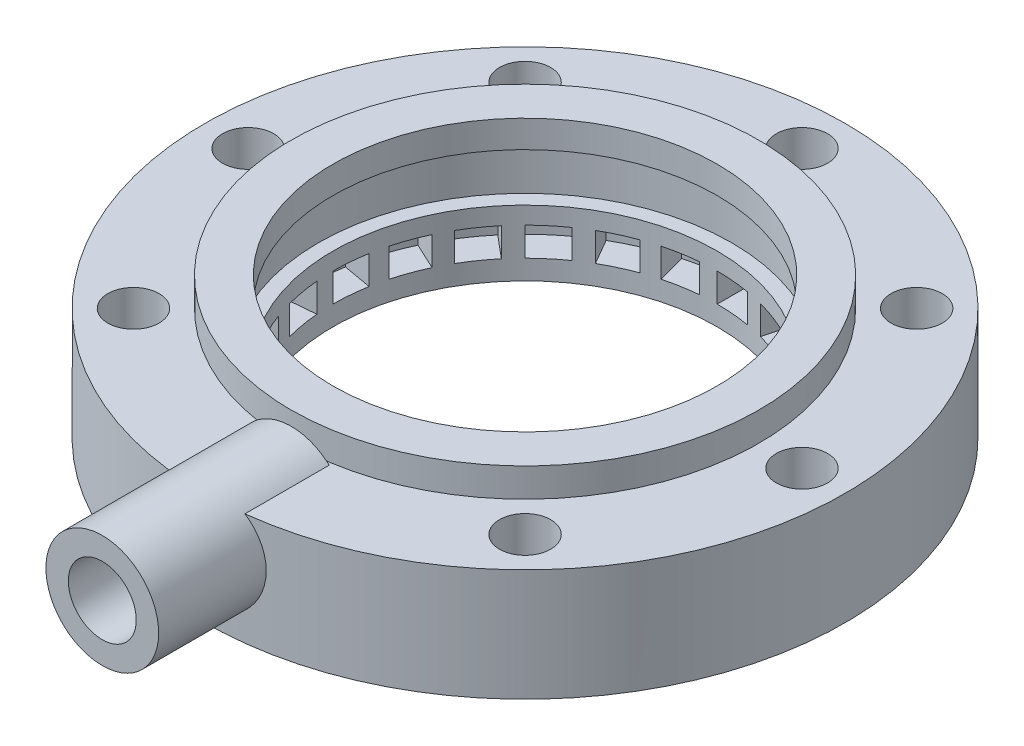
from build123d import *

# Parameters (mm, degrees)
SKETCH2_R               = 100
BOSS_EXTRUDE1_DEPTH     = 35
SKETCH3_R               = 60
CUT_EXTRUDE1_DEPTH      = 60
SKETCH4_R               = 73
BOSS_EXTRUDE3_DEPTH     = 44
SKETCH5_R               = 60
CUT_EXTRUDE2_DEPTH      = 60
SKETCH6_R               = 8
CUT_EXTRUDE3_DEPTH      = 146.688022843
SKETCH9_W               = 8
SKETCH9_H               = 8.939618961
CUT_REVOLVE2_ANGLE      = 10
CIRPATTERN1_COUNT       = 24
SKETCH10_W              = 4.5
SKETCH10_H              = 15
SKETCH11_W              = 1.287902171
SKETCH11_H              = 5.049148502
CUT_REVOLVE9_ANGLE      = 10
CIRPATTERN3_COUNT       = 24
SKETCH12_W              = 2.5
SKETCH12_H              = 25.096149883
CUT_REVOLVE13_ANGLE     = 10
CIRPATTERN4_COUNT       = 24
CUT_EXTRUDE4_DEPTH      = 34
CUT_EXTRUDE4_DEPTH_BACK = 6
SKETCH16_R              = 14
SKETCH19_W              = 2.480119558
SKETCH19_H              = 12.542318907
SKETCH20_R              = 17.602842061
SKETCH20_R_2            = 10.602842061
EXTRUDE_THIN1_DEPTH     = 59


with BuildPart() as part:
    # Sketch2 → Boss-Extrude1 (new body)
    with BuildSketch(Plane(origin=(0, 0, 0), x_dir=(1, 0, 0), z_dir=(0, 1, 0))):
        with Locations(Location((0, 0, 0), (0, 0, 270))):
            Circle(SKETCH2_R)
    extrude(amount=BOSS_EXTRUDE1_DEPTH)

    # Sketch3 → Cut-Extrude1 (cut)
    with BuildSketch(Plane(origin=(0, 0, 0), x_dir=(1, 0, 0), z_dir=(0, 1, 0))):
        with Locations(Location((0, 0, 0), (0, 0, 270))):
            Circle(SKETCH3_R)
    extrude(amount=CUT_EXTRUDE1_DEPTH, mode=Mode.SUBTRACT)

    # Sketch4 → Boss-Extrude3 (add)
    with BuildSketch(Plane(origin=(0, 0, 0), x_dir=(1, 0, 0), z_dir=(0, 1, 0))):
        with Locations(Location((0, 0, 0), (0, 0, 270))):
            Circle(SKETCH4_R)
    extrude(amount=BOSS_EXTRUDE3_DEPTH)

    # Sketch5 → Cut-Extrude2 (cut)
    with BuildSketch(Plane(origin=(0, 44, 0), x_dir=(1, 0, 0), z_dir=(0, 1, 0))):
        with Locations(Location((0, 0, 0), (0, 0, 270))):
            Circle(SKETCH5_R)
    extrude(amount=-CUT_EXTRUDE2_DEPTH, mode=Mode.SUBTRACT)

    # Sketch6 → Cut-Extrude3 (cut, through all)
    with BuildSketch(Plane(origin=(0, 35, 0), x_dir=(1, 0, 0), z_dir=(0, 1, 0))):
        with Locations(Location((0, 86.458470827, 0), (0, 0, 270))):
            Circle(SKETCH6_R)
        with Locations(Location((61.135371013, 61.135371013, 0), (0, 0, 270))):
            Circle(SKETCH6_R)
        with Locations(Location((86.458470827, 0, 0), (0, 0, 270))):
            Circle(SKETCH6_R)
        with Locations(Location((61.135371013, -61.135371013, 0), (0, 0, 270))):
            Circle(SKETCH6_R)
        with Locations(Location((-61.135371013, -61.135371013, 0), (0, 0, 270))):
            Circle(SKETCH6_R)
        with Locations(Location((-86.458470827, 0, 0), (0, 0, 270))):
            Circle(SKETCH6_R)
        with Locations(Location((-61.135371013, 61.135371013, 0), (0, 0, 270))):
            Circle(SKETCH6_R)
    extrude(amount=-CUT_EXTRUDE3_DEPTH, mode=Mode.SUBTRACT)

    # Sketch9 → Cut-Revolve2 (revolve, cut)
    with BuildSketch(Plane.XY):
        with Locations((-64, 10.60961882)):
            Rectangle(SKETCH9_W, SKETCH9_H)
    cut_revolve2 = revolve(axis=Axis((0, 44, 0), (0, -1, 0)), revolution_arc=CUT_REVOLVE2_ANGLE, mode=Mode.SUBTRACT)

    # CirPattern1: Cut-Revolve2 ×24 about axis, 2 skipped
    cirpattern1_axis = Axis((0, 0, 0), (0, 1, 0))
    add([cut_revolve2.rotate(cirpattern1_axis, i * 360 / CIRPATTERN1_COUNT) for i in range(1, CIRPATTERN1_COUNT) if i not in (6, 7)], mode=Mode.SUBTRACT)

    # Sketch10 → Cut-Revolve4 (revolve, cut)
    with BuildSketch(Plane.XY, mode=Mode.PRIVATE) as cut_revolve4_sk:
        with Locations((-62.25, 28)):
            Rectangle(SKETCH10_W, SKETCH10_H)
    revolve(cut_revolve4_sk.sketch.rotate(Axis((0, 44, 0), (0, -1, 0)), 270), axis=Axis((0, 44, 0), (0, -1, 0)), mode=Mode.SUBTRACT)

    # Sketch11 → Cut-Revolve9 (revolve, cut)
    with BuildSketch(Plane.XY):
        with Locations((-67.356048915, 17.604002552)):
            Rectangle(SKETCH11_W, SKETCH11_H)
    cut_revolve9 = revolve(axis=Axis((0, 15.079428301, 0), (0, -1, 0)), revolution_arc=CUT_REVOLVE9_ANGLE, mode=Mode.SUBTRACT)

    # CirPattern3: Cut-Revolve9 ×24 about axis, 2 skipped
    cirpattern3_axis = Axis((0, 0, 0), (0, -1, 0))
    add([cut_revolve9.rotate(cirpattern3_axis, i * 360 / CIRPATTERN3_COUNT) for i in range(1, CIRPATTERN3_COUNT) if i not in (17, 18)], mode=Mode.SUBTRACT)

    # Sketch12 → Cut-Revolve13 (revolve, cut)
    with BuildSketch(Plane.XY):
        with Locations((-67.885371013, 18.687884282)):
            Rectangle(SKETCH12_W, SKETCH12_H)
    cut_revolve13 = revolve(axis=Axis((0, 44, 0), (0, -1, 0)), revolution_arc=CUT_REVOLVE13_ANGLE, mode=Mode.SUBTRACT)

    # CirPattern4: Cut-Revolve13 ×24 about axis, 2 skipped
    cirpattern4_axis = Axis((0, 0, 0), (0, -1, 0))
    add([cut_revolve13.rotate(cirpattern4_axis, i * 360 / CIRPATTERN4_COUNT) for i in range(1, CIRPATTERN4_COUNT) if i not in (17, 18)], mode=Mode.SUBTRACT)

    # Sketch16 → Cut-Extrude4 (cut, two sides: drawn at the far end of the back side and taken through both)
    with BuildSketch(Plane.XY.offset(73).offset(-CUT_EXTRUDE4_DEPTH_BACK)):
        with Locations((0, 22)):
            Circle(SKETCH16_R)
    extrude(amount=CUT_EXTRUDE4_DEPTH + CUT_EXTRUDE4_DEPTH_BACK, mode=Mode.SUBTRACT)

    # Sketch19 → Cut-Revolve14 (revolve, cut)
    with BuildSketch(Plane.XY, mode=Mode.PRIVATE) as cut_revolve14_sk:
        with Locations((-67.916023483, 25.049809136)):
            Rectangle(SKETCH19_W, SKETCH19_H)
    revolve(cut_revolve14_sk.sketch.rotate(Axis((0, 46.2, 0), (0, -1, 0)), 270), axis=Axis((0, 46.2, 0), (0, -1, 0)), mode=Mode.SUBTRACT)


with BuildPart() as body_2:
    # Sketch20 → Extrude-Thin1 (new body)
    with BuildSketch(Plane.XY.offset(73)):
        with Locations((0, 22)):
            Circle(SKETCH20_R)
        with Locations((0, 22)):
            Circle(SKETCH20_R_2, mode=Mode.SUBTRACT)
    extrude(amount=EXTRUDE_THIN1_DEPTH)


solid = Compound([part.part, body_2.part])
